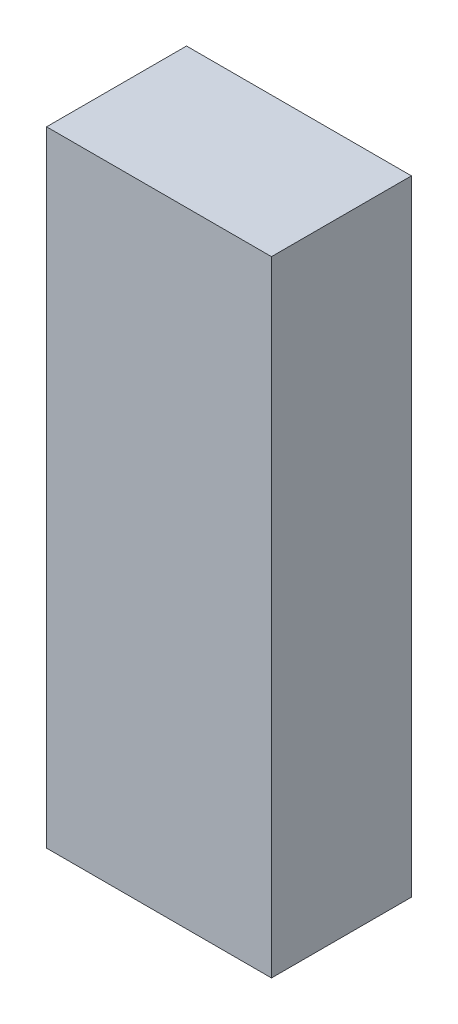
from build123d import *

# Parameters (mm, degrees)
CROQUIS1_W              = 45
CROQUIS1_H              = 28
SALIENTE_EXTRUIR1_DEPTH = 125


with BuildPart() as part:
    # Croquis1 → Saliente-Extruir1 (new body)
    with BuildSketch(Plane(origin=(0, 0, 0), x_dir=(1, 0, 0), z_dir=(0, 1, 0))):
        Rectangle(CROQUIS1_W, CROQUIS1_H)
    extrude(amount=SALIENTE_EXTRUIR1_DEPTH)


solid = part.part
